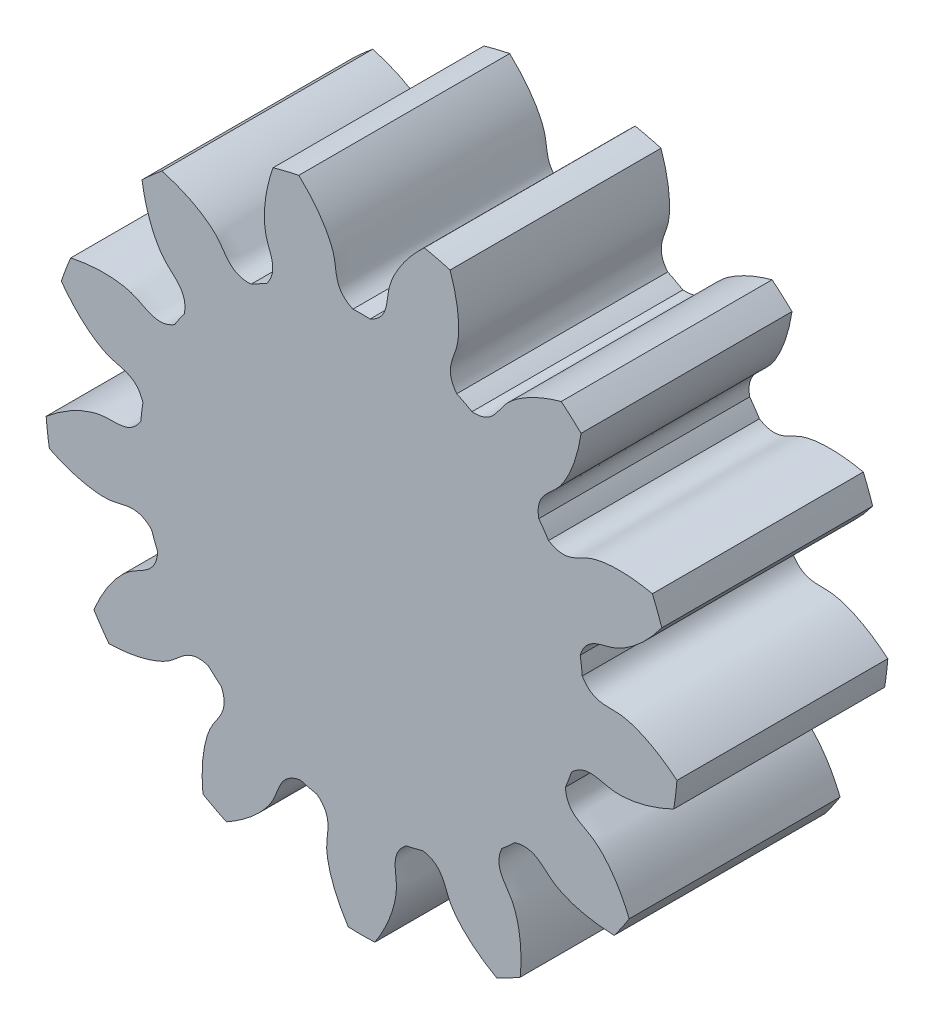
from build123d import *

# Parameters (mm, degrees)
SKETCH_1_R               = 7.500000002
EXTRUDE_1_DEPTH          = 5
CUT_EXTRUDE_1_DEPTH      = 12.726039402
PATTERN_CIRCULAR_1_COUNT = 13


with BuildPart() as part:
    # 草图1 → 凸台-拉伸1 (new body)
    with BuildSketch(Plane.XY):
        Circle(SKETCH_1_R)
    extrude(amount=EXTRUDE_1_DEPTH)

    # 草图2 → 切除-拉伸1 (cut, through all)
    with BuildSketch(Plane.XY):
        with BuildLine():
            ThreePointArc((0.203252029, 5.246064107), (0, 5.25), (-0.203252029, 5.246064107))
            add(Edge.make_bspline(
                [(-0.203252029, 5.246064107), (-0.662693667, 5.449587024), (-0.573366178, 5.831154556), (-0.669907783, 6.170720446), (-0.676693772, 6.192917735), (-0.684683798, 6.217296734), (-0.69396537, 6.243817682), (-0.704627701, 6.272437612), (-0.716757911, 6.303111031), (-0.7304421, 6.335789754), (-0.745764932, 6.370422997), (-0.762809665, 6.406957395), (-0.781658055, 6.445337045), (-0.802390294, 6.485503541), (-0.825084942, 6.527396016), (-0.84981886, 6.570951187), (-0.876667148, 6.616103394), (-0.905703076, 6.66278465), (-0.936998025, 6.710924685), (-0.970621423, 6.760450997), (-1.006640687, 6.811288901), (-1.045121161, 6.863361581), (-1.086126059, 6.916590144), (-1.129716409, 6.970893673), (-1.175950996, 7.026189286), (-1.22488631, 7.08239219), (-1.276576492, 7.139415746), (-1.331073282, 7.197171521), (-1.388425972, 7.255569357), (-1.448681357, 7.314517428), (-1.511883686, 7.373922311), (-1.578074619, 7.433689044), (-1.647293185, 7.493721197), (-1.719575736, 7.553920938), (-1.794955912, 7.614189103), (-1.873464598, 7.674425263), (-1.95512989, 7.734527798), (-2.039977058, 7.794393967), (-2.128028515, 7.853919979), (-2.219303783, 7.91300107), (-2.313819467, 7.971531575), (-2.411589222, 8.029405002), (-2.512623731, 8.08651411), (-2.616930679, 8.142750987), (-2.724514731, 8.198007122), (-2.835377515, 8.252173487), (-2.949517585, 8.305140615), (-3.107559068, 8.374673999), (-3.22876586, 8.423677332), (-3.310939818, 8.455038137)],
                knots=[0, 0, 0, 0, 0.219123219, 0.223606469, 0.228617161, 0.234155295, 0.240220869, 0.246813885, 0.253934342, 0.26158224, 0.26975758, 0.27846036, 0.287690582, 0.297448246, 0.30773335, 0.318545896, 0.329885883, 0.341753311, 0.354148181, 0.367070492, 0.380520244, 0.394497437, 0.409002072, 0.424034148, 0.439593665, 0.455680623, 0.472295023, 0.489436863, 0.507106146, 0.525302869, 0.544027034, 0.563278639, 0.583057687, 0.603364175, 0.624198105, 0.645559476, 0.667448288, 0.689864541, 0.712808236, 0.736279372, 0.760277949, 0.784803967, 0.809857427, 0.835438328, 0.86154667, 0.888182454, 0.915345678, 0.943036344, 1, 1, 1, 1], degree=3))
            ThreePointArc((-3.310939818, 8.455038137), (0, 9.080197816), (3.310939818, 8.455038137))
            add(Edge.make_bspline(
                [(0.203252029, 5.246064107), (0.662693667, 5.449587024), (0.573366178, 5.831154556), (0.669907783, 6.170720446), (0.676693772, 6.192917735), (0.684683798, 6.217296734), (0.69396537, 6.243817682), (0.704627701, 6.272437612), (0.716757911, 6.303111031), (0.7304421, 6.335789754), (0.745764932, 6.370422997), (0.762809665, 6.406957395), (0.781658055, 6.445337045), (0.802390294, 6.485503541), (0.825084942, 6.527396016), (0.84981886, 6.570951187), (0.876667148, 6.616103394), (0.905703076, 6.66278465), (0.936998025, 6.710924685), (0.970621423, 6.760450997), (1.006640687, 6.811288901), (1.045121161, 6.863361581), (1.086126059, 6.916590144), (1.129716409, 6.970893673), (1.175950996, 7.026189286), (1.22488631, 7.08239219), (1.276576492, 7.139415746), (1.331073282, 7.197171521), (1.388425972, 7.255569357), (1.448681357, 7.314517428), (1.511883686, 7.373922311), (1.578074619, 7.433689044), (1.647293185, 7.493721197), (1.719575736, 7.553920938), (1.794955912, 7.614189103), (1.873464598, 7.674425263), (1.95512989, 7.734527798), (2.039977058, 7.794393967), (2.128028515, 7.853919979), (2.219303783, 7.91300107), (2.313819467, 7.971531575), (2.411589222, 8.029405002), (2.512623731, 8.08651411), (2.616930679, 8.142750987), (2.724514731, 8.198007122), (2.835377515, 8.252173487), (2.949517585, 8.305140615), (3.107559068, 8.374673999), (3.22876586, 8.423677332), (3.310939818, 8.455038137)],
                knots=[0, 0, 0, 0, 0.219123219, 0.223606469, 0.228617161, 0.234155295, 0.240220869, 0.246813885, 0.253934342, 0.26158224, 0.26975758, 0.27846036, 0.287690582, 0.297448246, 0.30773335, 0.318545896, 0.329885883, 0.341753311, 0.354148181, 0.367070492, 0.380520244, 0.394497437, 0.409002072, 0.424034148, 0.439593665, 0.455680623, 0.472295023, 0.489436863, 0.507106146, 0.525302869, 0.544027034, 0.563278639, 0.583057687, 0.603364175, 0.624198105, 0.645559476, 0.667448288, 0.689864541, 0.712808236, 0.736279372, 0.760277949, 0.784803967, 0.809857427, 0.835438328, 0.86154667, 0.888182454, 0.915345678, 0.943036344, 1, 1, 1, 1], degree=3))
        make_face()
    cut_extrude_1 = extrude(amount=CUT_EXTRUDE_1_DEPTH, mode=Mode.SUBTRACT)

    # 阵列(圆周)1: 切除-拉伸1 ×13 about axis
    pattern_circular_1_axis = Axis((0, 0, -0.25), (0, 0, 1))
    for i in range(1, PATTERN_CIRCULAR_1_COUNT):
        add(cut_extrude_1.rotate(pattern_circular_1_axis, i * 360 / PATTERN_CIRCULAR_1_COUNT), mode=Mode.SUBTRACT)


solid = part.part
